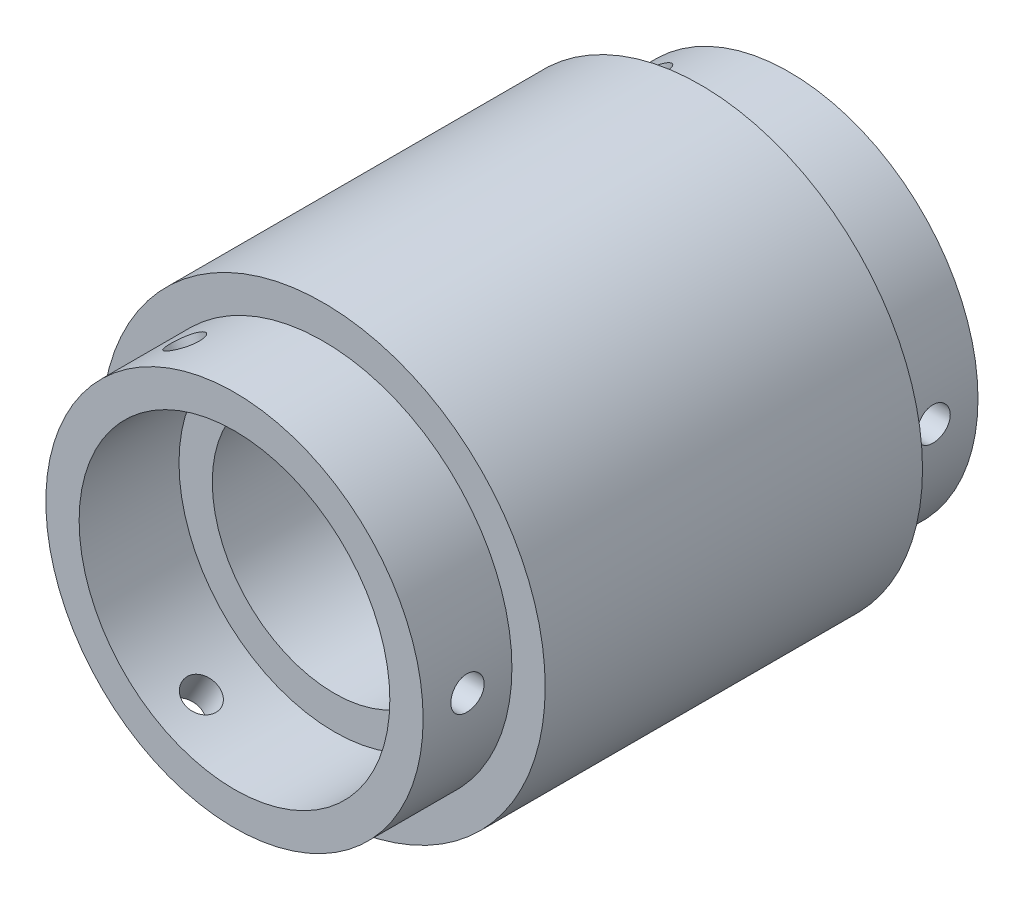
from build123d import *

# Parameters (mm, degrees)
SKETCH1_R               = 20
BOSS_EXTRUDE1_DEPTH     = 25
SKETCH4_R               = 20
SKETCH4_R_2             = 17
CUT_EXTRUDE1_DEPTH      = 8
CUT_EXTRUDE2_REACH      = 39.749
CUT_EXTRUDE2_END_RADIUS = 17
SKETCH5_R               = 1.5
CIRPATTERN1_COUNT       = 3


with BuildPart() as part:
    # Sketch1 → Boss-Extrude1 (new, symmetric)
    with BuildSketch(Plane.XY):
        Circle(SKETCH1_R)
    extrude(amount=BOSS_EXTRUDE1_DEPTH, both=True)

    # Sketch3 → Hole1 (revolve, cut)
    with BuildSketch(Plane(origin=(0, 0, 25), x_dir=(0, -1, 0), z_dir=(1, 0, 0))):
        Polygon((0, 0), (0, 56.609466809), (11, 50), (11, 9), (14, 9), (14, 0), align=None)
    hole1 = revolve(axis=Axis((0, 0, 36.310875039), (0, 0, -1)), mode=Mode.SUBTRACT)

    # Sketch4 → Cut-Extrude1 (cut)
    with BuildSketch(Plane.XY.offset(25)):
        Circle(SKETCH4_R)
        Circle(SKETCH4_R_2, mode=Mode.SUBTRACT)
    cut_extrude1 = extrude(amount=-CUT_EXTRUDE1_DEPTH, mode=Mode.SUBTRACT)

    # Mirror2: Hole1, Cut-Extrude1 across plane
    add(hole1.mirror(Plane.XY), mode=Mode.SUBTRACT)
    add(cut_extrude1.mirror(Plane.XY), mode=Mode.SUBTRACT)

    # Cut-Extrude2: up to this cylinder (the profile starts inside it)
    cut_extrude2_end = Plane(origin=(0, 0, 0), z_dir=(0, 0, 1)) * Cylinder(CUT_EXTRUDE2_END_RADIUS, 156.498, mode=Mode.PRIVATE)
    # Sketch5 → Cut-Extrude2 (cut, up to the surface)
    with BuildSketch(Plane(origin=(0, 0, 0), x_dir=(0, 0, -1), z_dir=(1, 0, 0)), mode=Mode.PRIVATE) as cut_extrude2_sk1:
        with Locations(Location((-21, 0, 0), (0, 0, 180))):
            Circle(SKETCH5_R)
    cut_extrude2_tool1 = extrude(cut_extrude2_sk1.sketch, amount=CUT_EXTRUDE2_REACH, mode=Mode.PRIVATE) & cut_extrude2_end
    # Sketch5 → Cut-Extrude2 (cut, up to the surface)
    with BuildSketch(Plane(origin=(0, 0, 0), x_dir=(0, 0, -1), z_dir=(1, 0, 0)), mode=Mode.PRIVATE) as cut_extrude2_sk2:
        with Locations(Location((21, 0, 0), (0, 0, 180))):
            Circle(SKETCH5_R)
    cut_extrude2_tool2 = extrude(cut_extrude2_sk2.sketch, amount=CUT_EXTRUDE2_REACH, mode=Mode.PRIVATE) & cut_extrude2_end
    cut_extrude2 = cut_extrude2_tool1.solids().sort_by_distance((0, 0, 21))[0] + cut_extrude2_tool2.solids().sort_by_distance((0, 0, -21))[0]
    add(cut_extrude2, mode=Mode.SUBTRACT)

    # CirPattern1: Cut-Extrude2 ×3 about axis
    cirpattern1_axis = Axis((0, 0, 25), (0, 0, 1))
    for i in range(1, CIRPATTERN1_COUNT):
        add(cut_extrude2.rotate(cirpattern1_axis, i * 360 / CIRPATTERN1_COUNT), mode=Mode.SUBTRACT)


solid = part.part
